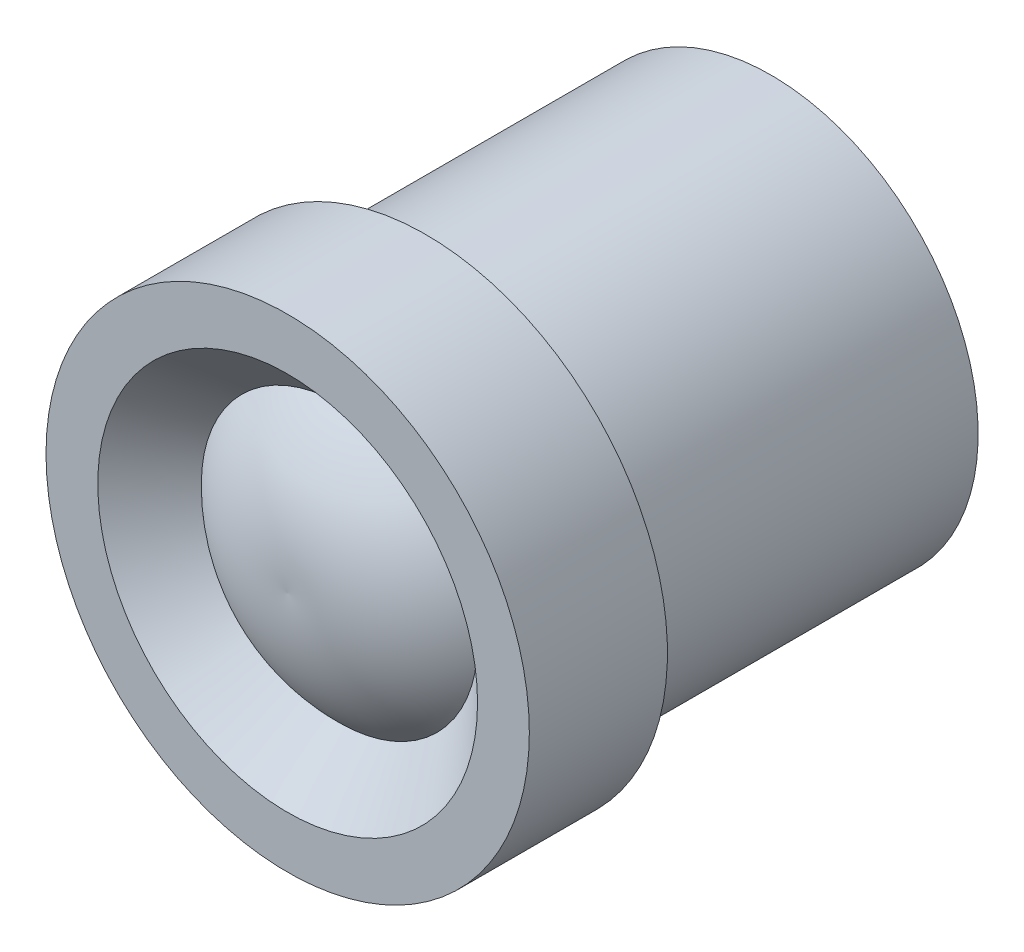
from build123d import *

# Parameters (mm, degrees)
SKETCH1_R           = 7
BOSS_EXTRUDE1_DEPTH = 14
SKETCH2_OUTSIDE_W   = 20.85
SKETCH2_OUTSIDE_H   = 20.85
SKETCH2_OUTSIDE_R   = 6
CUT_EXTRUDE1_DEPTH  = 10
SKETCH3_R           = 5.5
CUT_EXTRUDE2_DEPTH  = 1.5
CUT_EXTRUDE2_DRAFT  = -45
SKETCH4_R           = 4
CUT_EXTRUDE3_DEPTH  = 12.5
SKETCH5_R           = 4
BOSS_EXTRUDE3_DEPTH = 12.5


with BuildPart() as part:
    # Sketch1 → Boss-Extrude1 (new body)
    with BuildSketch(Plane.XY):
        Circle(SKETCH1_R)
    extrude(amount=BOSS_EXTRUDE1_DEPTH)

    # Sketch2 outside → Cut-Extrude1 (cut)
    with BuildSketch(Plane(origin=(0, 0, 0), x_dir=(-1, 0, 0), z_dir=(0, 0, -1))):
        Rectangle(SKETCH2_OUTSIDE_W, SKETCH2_OUTSIDE_H)
        Circle(SKETCH2_OUTSIDE_R, mode=Mode.SUBTRACT)
    extrude(amount=-CUT_EXTRUDE1_DEPTH, mode=Mode.SUBTRACT)


with BuildPart() as cut_extrude2_tool:
    # Sketch3 → Cut-Extrude2 (with draft: the straight prism first)
    with BuildSketch(Plane.XY.offset(14)):
        Circle(SKETCH3_R)
    extrude(amount=-CUT_EXTRUDE2_DEPTH)
    # Cut-Extrude2: the draft: its side faces are tilted about the plane it starts from
    cut_extrude2_sides = [cut_extrude2_tool.faces().sort_by_distance(p)[0] for p in [
        (-5.5, 0, 13.25),
    ]]
    draft(cut_extrude2_sides, Plane.XY.offset(14), CUT_EXTRUDE2_DRAFT)


with BuildPart() as part_1:
    add(part.part)

    # Cut-Extrude2: cut by cut_extrude2_tool
    add(cut_extrude2_tool.part, mode=Mode.SUBTRACT)

    # Sketch4 → Cut-Extrude3 (cut)
    with BuildSketch(Plane.XY.offset(12.5)):
        Circle(SKETCH4_R)
    extrude(amount=-CUT_EXTRUDE3_DEPTH, mode=Mode.SUBTRACT)



with BuildPart() as body_2:
    # Sketch5 → Boss-Extrude3 (new body)
    with BuildSketch(Plane(origin=(0, 0, 0), x_dir=(-1, 0, 0), z_dir=(0, 0, -1))):
        with Locations(Location((0, 0, 0), (0, 0, 180))):
            Circle(SKETCH5_R)
    extrude(amount=-BOSS_EXTRUDE3_DEPTH)


with BuildPart() as part_2:
    add(part_1.part)

    add(body_2.part)  # Revolve1 merges body 2
    # Sketch6 → Revolve1 (revolve)
    with BuildSketch(Plane(origin=(0, 0, 0), x_dir=(1, 0, 0), z_dir=(0, 1, 0))):
        with BuildLine():
            Line((-4, -12.5), (0, -12.5))
            Line((0, -12.5), (0, -14))
            ThreePointArc((0, -14), (-2.168263504, -13.698702678), (-4, -12.5))
        make_face()
    revolve(axis=Axis((0, 0, 12.5), (0, 0, 1)))


solid = part_2.part
